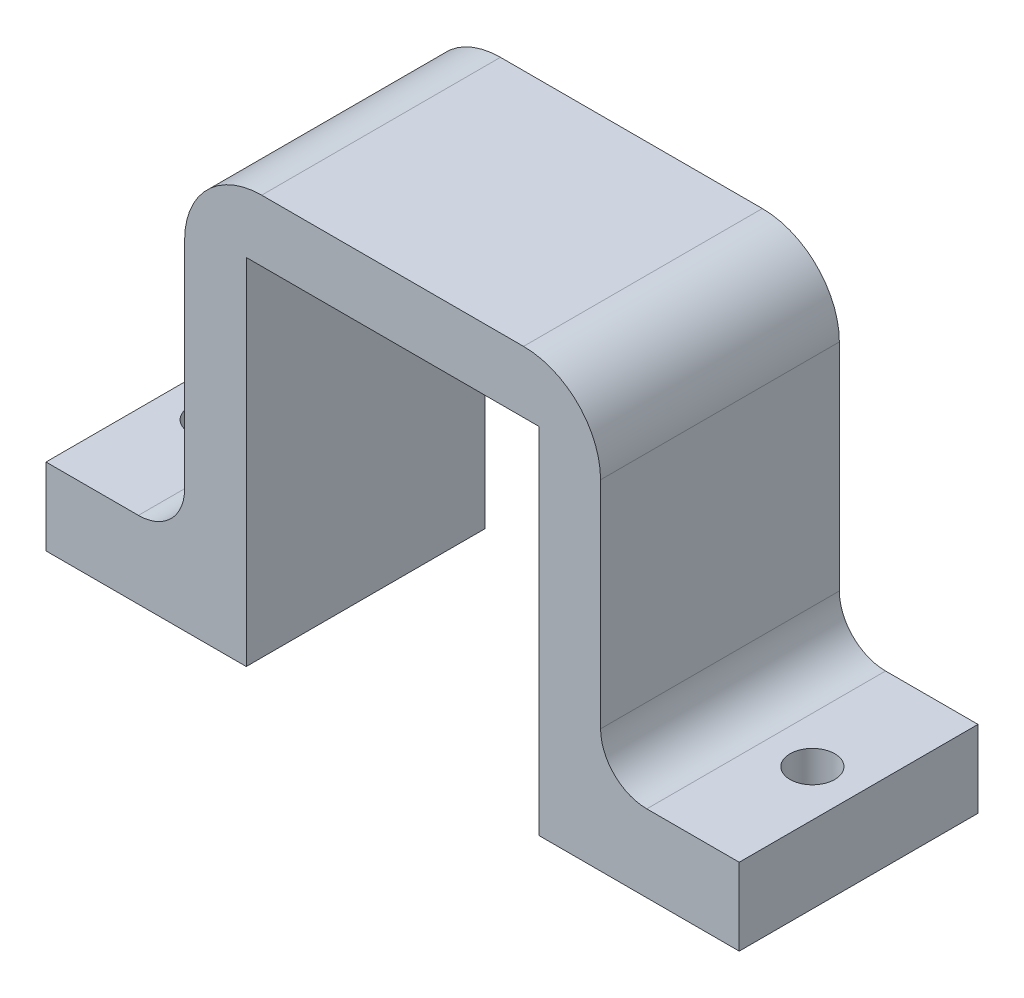
from build123d import *

# Parameters (mm, degrees)
BOSS_EXTRUDE1_DEPTH     = 23
CUT_EXTRUDE2_DEPTH      = 23
CUT_EXTRUDE2_DEPTH_BACK = 10
SKETCH4_W               = 3.5
SKETCH4_H               = 21
SKETCH5_W               = 45
SKETCH5_H               = 7.5
CUT_EXTRUDE3_DEPTH      = 26
SKETCH7_R               = 1.45
CUT_EXTRUDE4_DEPTH      = 50
SKETCH8_W               = 13
SKETCH8_H               = 15.5
BOSS_EXTRUDE2_DEPTH     = 1
SKETCH9_R               = 1.45
CUT_EXTRUDE5_DEPTH      = 10


with BuildPart() as part:
    # Sketch1 → Boss-Extrude1 (new body)
    with BuildSketch(Plane.XY):
        with BuildLine():
            Line((0, 3), (0, 17))
            ThreePointArc((0, 17), (1.464466094, 20.535533906), (5, 22))
            Line((5, 22), (22, 22))
            ThreePointArc((22, 22), (25.535533906, 20.535533906), (27, 17))
            Line((27, 17), (27, 3))
            ThreePointArc((27, 3), (27.878679656, 0.878679656), (30, 0))
            Line((30, 0), (36, 0))
            Line((36, 0), (36, -4))
            Line((36, -4), (23, -4))
            Line((23, -4), (23, 18))
            Line((23, 18), (4, 18))
            Line((4, 18), (4, -4))
            Line((4, -4), (-9, -4))
            Line((-9, -4), (-9, 0))
            Line((-9, 0), (-3, 0))
            ThreePointArc((-3, 0), (-0.878679656, 0.878679656), (0, 3))
        make_face()
    extrude(amount=BOSS_EXTRUDE1_DEPTH)

    # Sketch4 → Cut-Extrude2 (cut, two sides: drawn at the far end of the back side and taken through both)
    with BuildSketch(Plane.ZY.offset(-CUT_EXTRUDE2_DEPTH_BACK)):
        with Locations((5.75, 6.5)):
            Rectangle(SKETCH4_W, SKETCH4_H)
    extrude(amount=CUT_EXTRUDE2_DEPTH + CUT_EXTRUDE2_DEPTH_BACK, mode=Mode.SUBTRACT)

    # Sketch5 → Cut-Extrude3 (cut)
    with BuildSketch(Plane(origin=(0, 22, 0), x_dir=(1, 0, 0), z_dir=(0, 1, 0))):
        with Locations((13.5, -3.75)):
            Rectangle(SKETCH5_W, SKETCH5_H)
    extrude(amount=-CUT_EXTRUDE3_DEPTH, mode=Mode.SUBTRACT)

    # Sketch7 → Cut-Extrude4 (cut)
    with BuildSketch(Plane(origin=(0, 0, 0), x_dir=(1, 0, 0), z_dir=(0, 1, 0))):
        with Locations(Location((-6, -15.25, 0), (0, 0, 270))):
            Circle(SKETCH7_R)
        with Locations(Location((33, -15.25, 0), (0, 0, 180))):
            Circle(SKETCH7_R)
    extrude(amount=-CUT_EXTRUDE4_DEPTH, mode=Mode.SUBTRACT)

    # Sketch8 → Boss-Extrude2 (add)
    with BuildSketch(Plane.XZ.offset(4)):
        with Locations((29.5, 15.25)):
            Rectangle(SKETCH8_W, SKETCH8_H)
        with Locations((-2.5, 15.25)):
            Rectangle(SKETCH8_W, SKETCH8_H)
    extrude(amount=BOSS_EXTRUDE2_DEPTH)

    # Sketch9 → Cut-Extrude5 (cut)
    with BuildSketch(Plane(origin=(0, -4, 0), x_dir=(1, 0, 0), z_dir=(0, 1, 0))):
        with Locations((33, -15.25)):
            Circle(SKETCH9_R)
        with Locations(Location((-6, -15.25, 0), (0, 0, 270))):
            Circle(SKETCH9_R)
    extrude(amount=-CUT_EXTRUDE5_DEPTH, mode=Mode.SUBTRACT)


solid = part.part
